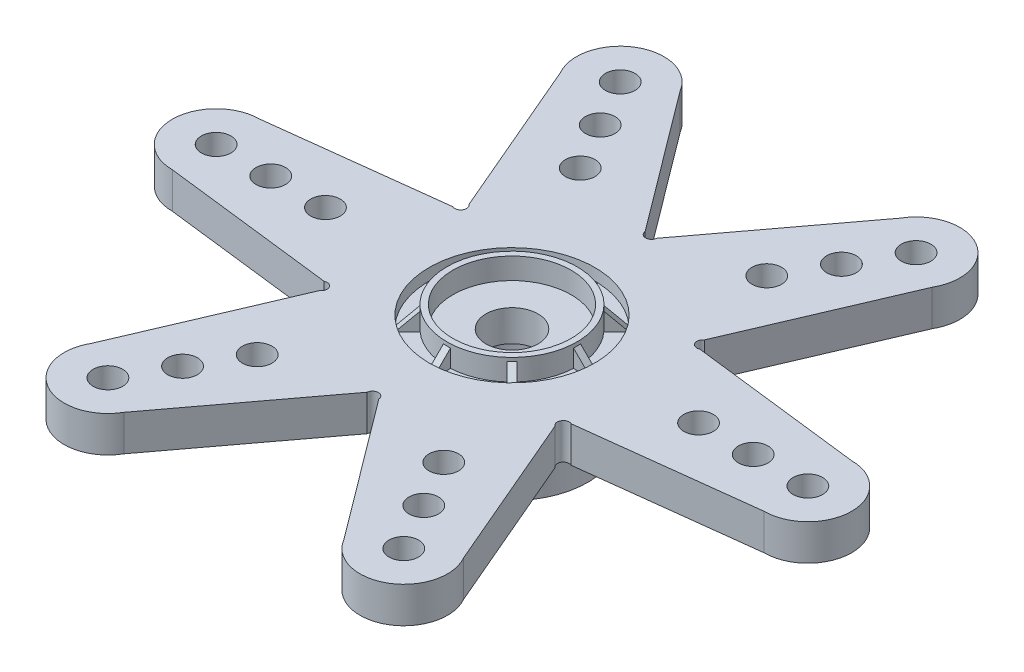
from build123d import *

# Parameters (mm, degrees)
EXTRUDE4_DEPTH          = 1.9304
SKETCH2_R               = 0.6604
CUT_EXTRUDE1_DEPTH      = 19.722050478
CIRPATTERN4_COUNT       = 6
CUT_EXTRUDE2_DEPTH      = 12.7
CUT_EXTRUDE2_DEPTH_BACK = 12.7
SKETCH3_R               = 1.397
SKETCH4_R               = 4.445
CUT_EXTRUDE3_DEPTH      = 0.635
SKETCH5_R               = 3.4925
SKETCH5_R_2             = 3.175
EXTRUDE5_DEPTH          = 1.143
RIB10_REACH             = 26.438
SKETCH8_WALL_W          = 52.220152264
SKETCH8_WALL_H          = 0.381
CIRPATTERN5_COUNT       = 8
SKETCH9_R               = 0.79375
CUT_EXTRUDE4_DEPTH      = 25.392925761
CIRPATTERN6_COUNT       = 6
SKETCH10_R              = 5.08
EXTRUDE6_DEPTH          = 0.762
FILLET2_R               = 0.508
SKETCH11_R              = 4.064
EXTRUDE7_DEPTH          = 3.048
FILLET3_R               = 0.889
SKETCH12_R              = 2.8575
CUT_EXTRUDE5_DEPTH      = 3.429
SKETCH14_R              = 1.397
CUT_EXTRUDE6_DEPTH      = 25.557003564
SKETCH15_R              = 0.3175
CUT_EXTRUDE7_DEPTH      = 25.984806887
CIRPATTERN7_COUNT       = 6


with BuildPart() as part:
    # Sketch1 → Extrude4 (new body)
    with BuildSketch(Plane(origin=(0, 0, 0), x_dir=(1, 0, 0), z_dir=(0, 1, 0))):
        with BuildLine():
            Line((5.775220615, -3.829827046), (0, 0))
            Line((0, 0), (5.775220615, 3.829827046))
            Line((5.775220615, 3.829827046), (6.35029977, 3.829827046))
            Line((6.35029977, 3.829827046), (6.35029977, 3.494998084))
            Line((6.35029977, 3.494998084), (15.87469147, 2.35207108))
            ThreePointArc((15.87469147, 2.35207108), (18.22419147, 0.00257108), (15.87469147, -2.34692892))
            Line((15.87469147, -2.34692892), (6.34969147, -3.48992892))
            Line((6.34969147, -3.48992892), (6.34969147, -3.829827046))
            Line((6.34969147, -3.829827046), (5.775220615, -3.829827046))
        make_face()
    extrude4 = extrude(amount=EXTRUDE4_DEPTH)

    # Sketch2 → Cut-Extrude1 (cut, through all)
    with BuildSketch(Plane(origin=(0, 1.9304, 0), x_dir=(-1, 0, 0), z_dir=(0, 1, 0))):
        with Locations((-6.342552501, -4.149920748)):
            Circle(SKETCH2_R)
        with Locations((-6.342552501, 4.149920748)):
            Circle(SKETCH2_R)
    extrude(amount=-CUT_EXTRUDE1_DEPTH, mode=Mode.SUBTRACT)

    # CirPattern4: Extrude4 ×6 about axis
    cirpattern4_axis = Axis((0, 0, 0), (0, 1, 0))
    for i in range(1, CIRPATTERN4_COUNT):
        add(extrude4.rotate(cirpattern4_axis, i * 360 / CIRPATTERN4_COUNT))

    # Sketch3 → Cut-Extrude2 (cut, two sides: drawn at the far end of the back side and taken through both)
    with BuildSketch(Plane(origin=(0, 1.9304, 0), x_dir=(-1, 0, 0), z_dir=(0, 1, 0)).offset(-CUT_EXTRUDE2_DEPTH_BACK)):
        with Locations(Location((0, 0, 0), (0, 0, 90))):
            Circle(SKETCH3_R)
    extrude(amount=CUT_EXTRUDE2_DEPTH + CUT_EXTRUDE2_DEPTH_BACK, mode=Mode.SUBTRACT)

    # Sketch4 → Cut-Extrude3 (cut)
    with BuildSketch(Plane(origin=(0, 1.9304, 0), x_dir=(-1, 0, 0), z_dir=(0, 1, 0))):
        with Locations(Location((0, 0, 0), (0, 0, 90))):
            Circle(SKETCH4_R)
    extrude(amount=-CUT_EXTRUDE3_DEPTH, mode=Mode.SUBTRACT)

    # Sketch5 → Extrude5 (add)
    with BuildSketch(Plane(origin=(0, 1.2954, 0), x_dir=(-1, 0, 0), z_dir=(0, 1, 0))):
        Circle(SKETCH5_R)
        Circle(SKETCH5_R_2, mode=Mode.SUBTRACT)
    extrude(amount=EXTRUDE5_DEPTH)

    # Sketch8 wall → Rib10 (add, up to next)
    with BuildSketch(Plane(origin=(-3.967749561, 1.770078976, 0), x_dir=(-0.70753138537, -0.706681921883, 0), z_dir=(0.706681921883, -0.70753138537, 0)), mode=Mode.PRIVATE) as rib10_sk1:
        Rectangle(SKETCH8_WALL_W, SKETCH8_WALL_H)
    rib10_tool1 = extrude(rib10_sk1.sketch, amount=RIB10_REACH, mode=Mode.PRIVATE) - part.part
    rib10 = rib10_tool1.solids().sort_by_distance((-3.967749561, 1.770078976, 0))[0]
    add(rib10)

    # CirPattern5: Rib10 ×8 about axis
    cirpattern5_axis = Axis((0, 0, 0), (0, 1, 0))
    for i in range(1, CIRPATTERN5_COUNT):
        add(rib10.rotate(cirpattern5_axis, i * 360 / CIRPATTERN5_COUNT))

    # Sketch9 → Cut-Extrude4 (cut, through all)
    with BuildSketch(Plane(origin=(0, 1.9304, 0), x_dir=(-1, 0, 0), z_dir=(0, 1, 0))):
        with Locations(Location((7.935119114, 13.749171631, 0), (0, 0, 90))):
            Circle(SKETCH9_R)
        with Locations(Location((6.469197887, 11.209171631, 0), (0, 0, 90))):
            Circle(SKETCH9_R)
        with Locations(Location((5.00327666, 8.669171631, 0), (0, 0, 90))):
            Circle(SKETCH9_R)
    cut_extrude4 = extrude(amount=-CUT_EXTRUDE4_DEPTH, mode=Mode.SUBTRACT)

    # CirPattern6: Cut-Extrude4 ×6 about axis
    cirpattern6_axis = Axis((0, 0, 0), (0, 1, 0))
    for i in range(1, CIRPATTERN6_COUNT):
        add(cut_extrude4.rotate(cirpattern6_axis, i * 360 / CIRPATTERN6_COUNT), mode=Mode.SUBTRACT)

    # Sketch10 → Extrude6 (add)
    with BuildSketch(Plane.XZ):
        with Locations(Location((0, 0, 0), (0, 0, 90))):
            Circle(SKETCH10_R)
    extrude(amount=EXTRUDE6_DEPTH)

    # Fillet2
    fillet2_edges = [part.edges().sort_by_distance(p)[0] for p in [
        (0, 0, -5.08),
    ]]
    fillet(fillet2_edges, radius=FILLET2_R)

    # Sketch11 → Extrude7 (add)
    with BuildSketch(Plane.XZ.offset(0.762)):
        with Locations(Location((0, 0, 0), (0, 0, 90))):
            Circle(SKETCH11_R)
    extrude(amount=EXTRUDE7_DEPTH)

    # Fillet3
    fillet3_edges = [part.edges().sort_by_distance(p)[0] for p in [
        (0, -0.762, -4.064),
    ]]
    fillet(fillet3_edges, radius=FILLET3_R)

    # Sketch12 → Cut-Extrude5 (cut)
    with BuildSketch(Plane.XZ.offset(3.81)):
        with Locations(Location((0, 0, 0), (0, 0, 270))):
            Circle(SKETCH12_R)
    extrude(amount=-CUT_EXTRUDE5_DEPTH, mode=Mode.SUBTRACT)

    # Sketch14 → Cut-Extrude6 (cut, through all)
    with BuildSketch(Plane.XZ.offset(0.381)):
        with Locations(Location((0, 0, 0), (0, 0, 90))):
            Circle(SKETCH14_R)
    extrude(amount=-CUT_EXTRUDE6_DEPTH, mode=Mode.SUBTRACT)

    # Sketch15 → Cut-Extrude7 (cut, symmetric)
    with BuildSketch(Plane(origin=(0, 1.9304, 0), x_dir=(-1, 0, 0), z_dir=(0, 1, 0))):
        with Locations((-6.48724684, -3.751940905)):
            Circle(SKETCH15_R)
    cut_extrude7 = extrude(amount=CUT_EXTRUDE7_DEPTH, both=True, mode=Mode.SUBTRACT)

    # CirPattern7: Cut-Extrude7 ×6 about axis
    cirpattern7_axis = Axis((0, 0, 0), (0, 1, 0))
    for i in range(1, CIRPATTERN7_COUNT):
        add(cut_extrude7.rotate(cirpattern7_axis, i * 360 / CIRPATTERN7_COUNT), mode=Mode.SUBTRACT)


solid = part.part
